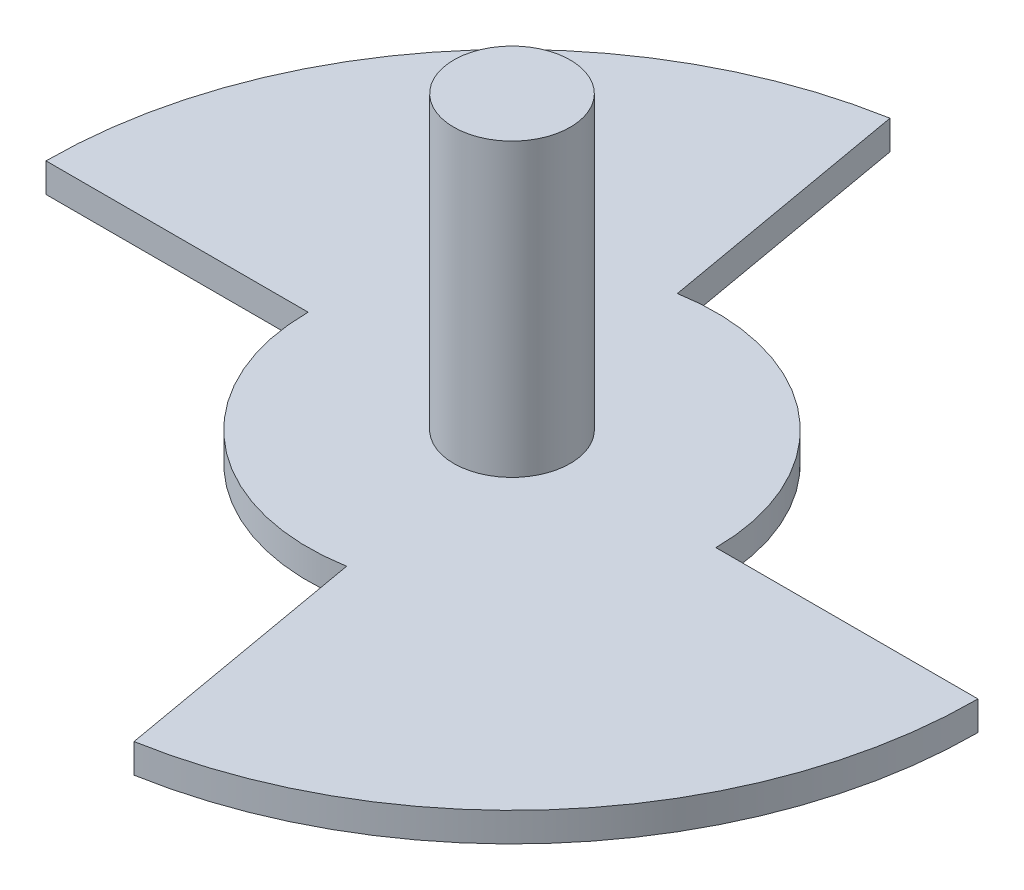
from build123d import *

# Parameters (mm, degrees)
SALIENTE_EXTRUIR1_DEPTH      = 0.25
SALIENTE_EXTRUIR1_DEPTH_BACK = 0.25
CROQUIS2_R                   = 1
SALIENTE_EXTRUIR2_DEPTH      = 5


with BuildPart() as part:
    # Croquis1 → Saliente-Extruir1 (new, two sides: drawn at the far end of the back side and taken through both)
    with BuildSketch(Plane(origin=(0, 0, 0), x_dir=(1, 0, 0), z_dir=(0, 1, 0)).offset(-SALIENTE_EXTRUIR1_DEPTH_BACK)):
        with BuildLine():
            Line((8, 0), (3.5, 0))
            ThreePointArc((3.5, 0), (2.249756634, 2.681155551), (-0.607768622, 3.446827136))
            Line((-0.607768622, 3.446827136), (-1.389185421, 7.878462024))
            ThreePointArc((-1.389185421, 7.878462024), (-6.128355545, 5.142300877), (-8, 0))
            Line((-8, 0), (-3.5, 0))
            ThreePointArc((-3.5, 0), (-2.249756634, -2.681155551), (0.607768622, -3.446827136))
            Line((0.607768622, -3.446827136), (1.389185421, -7.878462024))
            ThreePointArc((1.389185421, -7.878462024), (6.128355545, -5.142300877), (8, 0))
        make_face()
    extrude(amount=SALIENTE_EXTRUIR1_DEPTH + SALIENTE_EXTRUIR1_DEPTH_BACK)

    # Croquis2 → Saliente-Extruir2 (add)
    with BuildSketch(Plane(origin=(0, 0.25, 0), x_dir=(1, 0, 0), z_dir=(0, 1, 0))):
        Circle(CROQUIS2_R)
    extrude(amount=SALIENTE_EXTRUIR2_DEPTH)


solid = part.part
